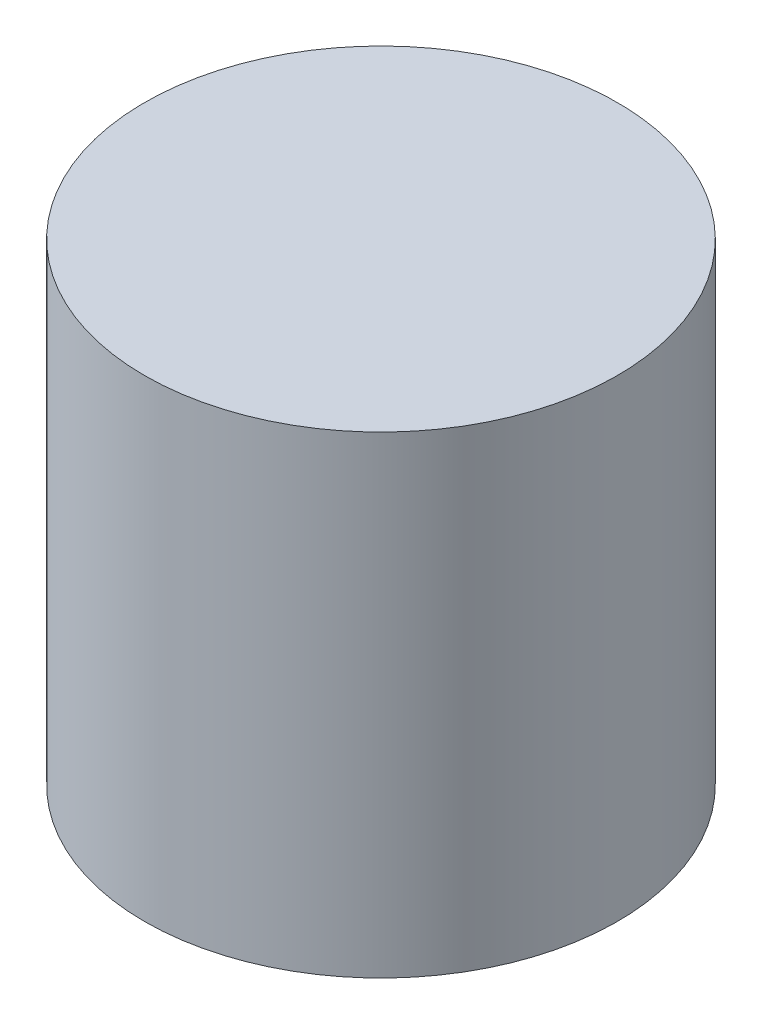
from build123d import *

# Parameters (mm, degrees)
ESQUISSE14_R       = 50
BOSS_EXTRU_2_DEPTH = 100


with BuildPart() as part:
    # Esquisse14 → Boss.-Extru.2 (new body)
    with BuildSketch(Plane(origin=(0, 0, 0), x_dir=(1, 0, 0), z_dir=(0, 1, 0))):
        with Locations(Location((0, 0, 0), (0, 0, 270))):
            Circle(ESQUISSE14_R)
    extrude(amount=BOSS_EXTRU_2_DEPTH)


solid = part.part
